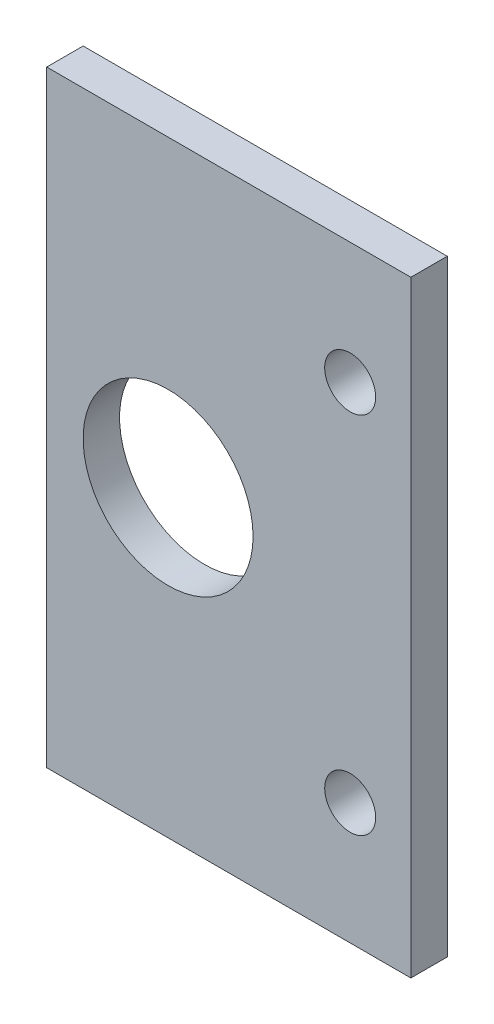
from build123d import *

# Parameters (mm, degrees)
SKETCH_1_W          = 30
SKETCH_1_H          = 50
EXTRUDE_1_DEPTH     = 3
SKETCH_2_R          = 7
SKETCH_2_R_2        = 2.1
CUT_EXTRUDE_1_DEPTH = 59.386642308


with BuildPart() as part:
    # 草图1 → 凸台-拉伸1 (new body)
    with BuildSketch(Plane.XY):
        with Locations((15, -25)):
            Rectangle(SKETCH_1_W, SKETCH_1_H)
    extrude(amount=EXTRUDE_1_DEPTH)

    # 草图2 → 切除-拉伸1 (cut, through all)
    with BuildSketch(Plane.XY.offset(3)):
        with Locations((10, -25)):
            Circle(SKETCH_2_R)
        with Locations((25, -10)):
            Circle(SKETCH_2_R_2)
        with Locations(Location((25, -40, 0), (0, 0, 180))):
            Circle(SKETCH_2_R_2)
    extrude(amount=-CUT_EXTRUDE_1_DEPTH, mode=Mode.SUBTRACT)


solid = part.part
